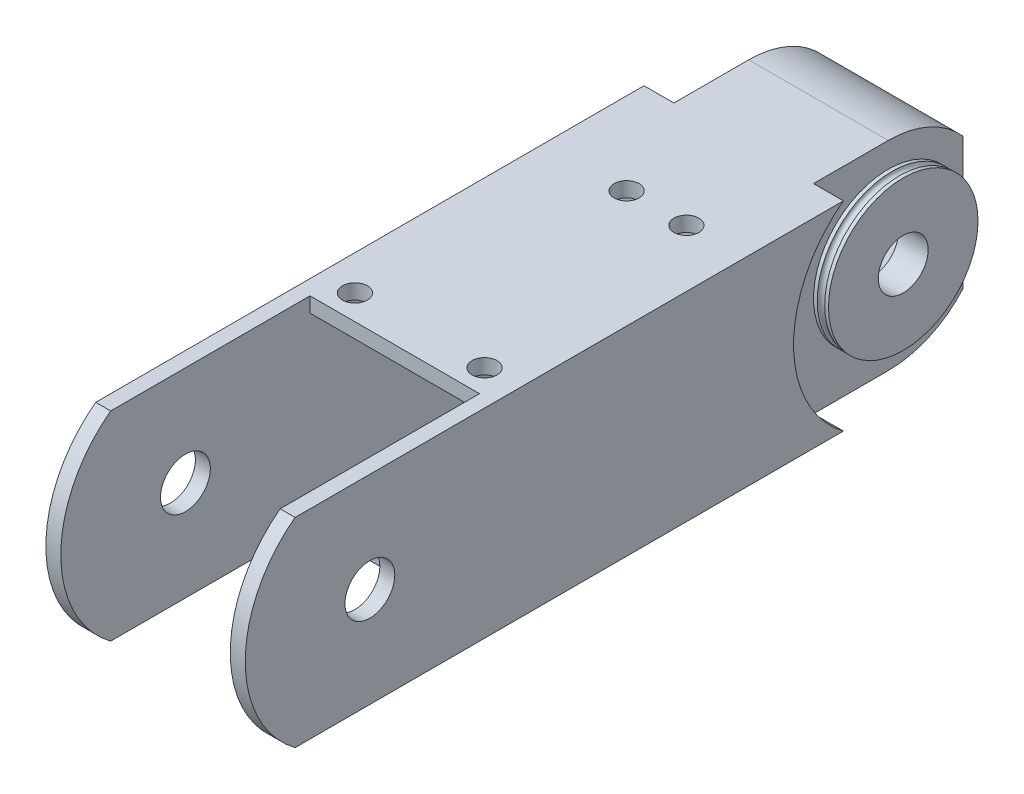
from build123d import *

# Parameters (mm, degrees)
CROQUIS1_W              = 40
CROQUIS1_H              = 40
SALIENTE_EXTRUIR1_DEPTH = 150
CROQUIS2_W              = 34
CROQUIS2_H              = 40
CORTAR_EXTRUIR1_DEPTH   = 50
CORTAR_EXTRUIR5_DEPTH   = 157.524758425
CROQUIS4_R              = 5
CORTAR_EXTRUIR6_DEPTH   = 157.524758425
CORTAR_EXTRUIR10_DEPTH  = 157.524758425
CROQUIS5_R              = 5
CORTAR_EXTRUIR7_DEPTH   = 157.524758425
CROQUIS6_R              = 5
CORTAR_EXTRUIR8_DEPTH   = 6
CORTAR_EXTRUIR11_START  = -6
CROQUIS9_R              = 5
CORTAR_EXTRUIR11_DEPTH  = 6
SALIENTE_EXTRUIR2_START = 3
CROQUIS10_R             = 15
CROQUIS10_R_2           = 5
SALIENTE_EXTRUIR2_DEPTH = 3
CROQUIS11_R             = 15
CROQUIS11_R_2           = 5
SALIENTE_EXTRUIR3_DEPTH = 3
CROQUIS12_R             = 0.75
CROQUIS13_R             = 2.5
CORTAR_EXTRUIR12_DEPTH  = 157.524758425
CROQUIS15_W             = 22
CROQUIS15_H             = 20.45751311
CORTAR_EXTRUIR14_DEPTH  = 95
CROQUIS17_W             = 34
CROQUIS17_H             = 34
CORTAR_EXTRUIR15_DEPTH  = 55
CROQUIS18_R             = 2.5
CORTAR_EXTRUIR16_DEPTH  = 157.524758425


with BuildPart() as part:
    # Croquis1 → Saliente-Extruir1 (new body)
    with BuildSketch(Plane.XY):
        Rectangle(CROQUIS1_W, CROQUIS1_H)
    extrude(amount=SALIENTE_EXTRUIR1_DEPTH)

    # Croquis2 → Cortar-Extruir1 (cut)
    with BuildSketch(Plane.XY.offset(150)):
        Rectangle(CROQUIS2_W, CROQUIS2_H)
    extrude(amount=-CORTAR_EXTRUIR1_DEPTH, mode=Mode.SUBTRACT)

    # Croquis3 → Cortar-Extruir5 (cut, through all)
    with BuildSketch(Plane(origin=(20, 0, 0), x_dir=(0, 0, -1), z_dir=(1, 0, 0))):
        with BuildLine():
            ThreePointArc((-140, -20), (-147.360679775, -11.180339887), (-150, 0))
            Line((-150, 0), (-150, -20))
            Line((-150, -20), (-140, -20))
        make_face()
        with BuildLine():
            Line((-140, 20), (-150, 20))
            Line((-150, 20), (-150, 0))
            ThreePointArc((-150, 0), (-147.360679775, 11.180339887), (-140, 20))
        make_face()
    extrude(amount=-CORTAR_EXTRUIR5_DEPTH, mode=Mode.SUBTRACT)

    # Croquis4 → Cortar-Extruir6 (cut, through all)
    with BuildSketch(Plane(origin=(20, 0, 0), x_dir=(0, 0, -1), z_dir=(1, 0, 0))):
        with Locations((-125, 0)):
            Circle(CROQUIS4_R)
    extrude(amount=-CORTAR_EXTRUIR6_DEPTH, mode=Mode.SUBTRACT)

    # Croquis8 → Cortar-Extruir10 (cut, through all)
    with BuildSketch(Plane(origin=(20, 0, 0), x_dir=(0, 0, -1), z_dir=(1, 0, 0))):
        with BuildLine():
            Line((0, 20), (-15, 20))
            ThreePointArc((-15, 20), (-6.771243445, 18.228756555), (0, 13.228756555))
            Line((0, 13.228756555), (0, 20))
        make_face()
        with BuildLine():
            Line((0, -20), (0, -13.228756555))
            ThreePointArc((0, -13.228756555), (-6.771243445, -18.228756555), (-15, -20))
            Line((-15, -20), (0, -20))
        make_face()
    extrude(amount=-CORTAR_EXTRUIR10_DEPTH, mode=Mode.SUBTRACT)

    # Croquis5 → Cortar-Extruir7 (cut, through all)
    with BuildSketch(Plane(origin=(20, 0, 0), x_dir=(0, 0, -1), z_dir=(1, 0, 0))):
        with Locations((-15, 0)):
            Circle(CROQUIS5_R)
    extrude(amount=-CORTAR_EXTRUIR7_DEPTH, mode=Mode.SUBTRACT)

    # Croquis6 → Cortar-Extruir8 (cut)
    with BuildSketch(Plane(origin=(20, 0, 0), x_dir=(0, 0, -1), z_dir=(1, 0, 0))):
        with BuildLine():
            ThreePointArc((-30, 20), (-40, 0), (-30, -20))
            Line((-30, -20), (-15, -20))
            ThreePointArc((-15, -20), (-6.771243445, -18.228756555), (0, -13.228756555))
            Line((0, -13.228756555), (0, 13.228756555))
            ThreePointArc((0, 13.228756555), (-6.771243445, 18.228756555), (-15, 20))
            Line((-15, 20), (-30, 20))
        make_face()
        with Locations((-15, 0)):
            Circle(CROQUIS6_R, mode=Mode.SUBTRACT)
    extrude(amount=-CORTAR_EXTRUIR8_DEPTH, mode=Mode.SUBTRACT)

    # Croquis9 → Cortar-Extruir11 (cut)
    with BuildSketch(Plane.ZY.offset(20).offset(CORTAR_EXTRUIR11_START)):
        with BuildLine():
            ThreePointArc((30, -20), (40, 0), (30, 20))
            Line((30, 20), (15, 20))
            ThreePointArc((15, 20), (6.771243445, 18.228756555), (0, 13.228756555))
            Line((0, 13.228756555), (0, -13.228756555))
            ThreePointArc((0, -13.228756555), (6.771243445, -18.228756555), (15, -20))
            Line((15, -20), (30, -20))
        make_face()
        with Locations(Location((15, 0, 0), (0, 0, 180))):
            Circle(CROQUIS9_R, mode=Mode.SUBTRACT)
    extrude(amount=CORTAR_EXTRUIR11_DEPTH, mode=Mode.SUBTRACT)

    # Croquis10 → Saliente-Extruir2 (add)
    with BuildSketch(Plane(origin=(14, 0, 0), x_dir=(0, 0, -1), z_dir=(1, 0, 0)).offset(SALIENTE_EXTRUIR2_START)):
        with Locations((-15, 0)):
            Circle(CROQUIS10_R)
        with Locations((-15, 0)):
            Circle(CROQUIS10_R_2, mode=Mode.SUBTRACT)
    extrude(amount=-SALIENTE_EXTRUIR2_DEPTH)

    # Croquis11 → Saliente-Extruir3 (add)
    with BuildSketch(Plane.ZY.offset(14)):
        with Locations(Location((15, 0, 0), (0, 0, 180))):
            Circle(CROQUIS11_R)
        with Locations(Location((15, 0, 0), (0, 0, 180))):
            Circle(CROQUIS11_R_2, mode=Mode.SUBTRACT)
    extrude(amount=SALIENTE_EXTRUIR3_DEPTH)

    # Croquis12 → Cortar-Revolución1 (revolve, cut)
    with BuildSketch(Plane.XY.offset(15), mode=Mode.PRIVATE) as cortar_revoluci_n1_sk:
        with Locations((15.5, 15)):
            Circle(CROQUIS12_R)
        with Locations((-15.5, 15)):
            Circle(CROQUIS12_R)
    revolve(cortar_revoluci_n1_sk.sketch.rotate(Axis((-18, 0, 15), (1, 0, 0)), 270), axis=Axis((-18, 0, 15), (1, 0, 0)), mode=Mode.SUBTRACT)

    # Croquis13 → Cortar-Extruir12 (cut, through all)
    with BuildSketch(Plane.XZ.offset(20)):
        with Locations(Location((13, 95, 0), (0, 0, 270))):
            Circle(CROQUIS13_R)
        with Locations(Location((-13, 95, 0), (0, 0, 270))):
            Circle(CROQUIS13_R)
    extrude(amount=-CORTAR_EXTRUIR12_DEPTH, mode=Mode.SUBTRACT)

    # Croquis15 → Cortar-Extruir14 (cut)
    with BuildSketch(Plane(origin=(0, 0, 0), x_dir=(-1, 0, 0), z_dir=(0, 0, -1))):
        Rectangle(CROQUIS15_W, CROQUIS15_H)
    extrude(amount=-CORTAR_EXTRUIR14_DEPTH, mode=Mode.SUBTRACT)

    # Croquis17 → Cortar-Extruir15 (cut)
    with BuildSketch(Plane.XY.offset(100)):
        Rectangle(CROQUIS17_W, CROQUIS17_H)
    extrude(amount=-CORTAR_EXTRUIR15_DEPTH, mode=Mode.SUBTRACT)

    # Croquis18 → Cortar-Extruir16 (cut, through all)
    with BuildSketch(Plane(origin=(0, 20, 0), x_dir=(1, 0, 0), z_dir=(0, 1, 0))):
        with Locations(Location((8.5, -50, 0), (0, 0, 270))):
            Circle(CROQUIS18_R)
        with Locations(Location((-3.5, -50, 0), (0, 0, 270))):
            Circle(CROQUIS18_R)
    extrude(amount=-CORTAR_EXTRUIR16_DEPTH, mode=Mode.SUBTRACT)


solid = part.part
